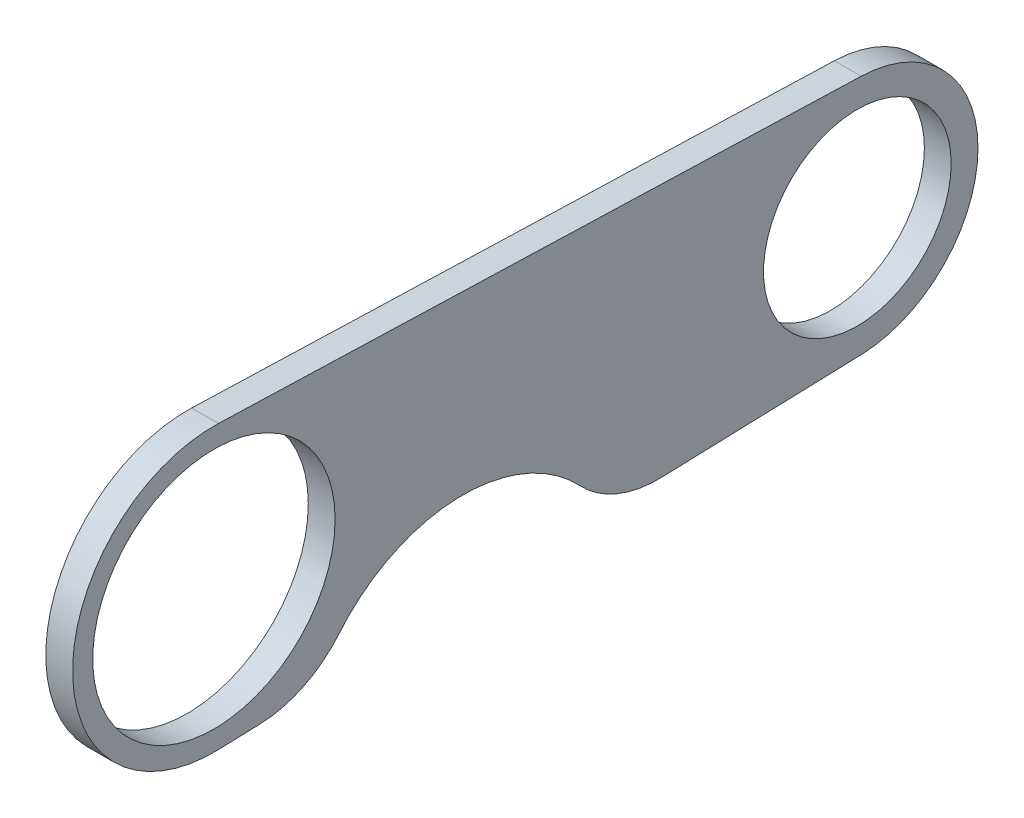
from build123d import *

# Parameters (mm, degrees)
SKETCH1_R           = 14.351
SKETCH1_R_2         = 11.1125
BOSS_EXTRUDE1_DEPTH = 3.175
SKETCH2_R           = 19.05
CUT_EXTRUDE1_DEPTH  = 58.416238601
FILLET1_R           = 12.7


with BuildPart() as part:
    # Sketch1 → Boss-Extrude1 (new body)
    with BuildSketch(Plane(origin=(0, 0, 0), x_dir=(0, 0, -1), z_dir=(1, 0, 0))):
        with BuildLine():
            Line((-37.563173646, 16.723636193), (38.558390625, 14.280144757))
            ThreePointArc((38.558390625, 14.280144757), (52.3875, 0), (38.558390625, -14.280144757))
            Line((38.558390625, -14.280144757), (-37.563173646, -16.723636193))
            ThreePointArc((-37.563173646, -16.723636193), (-54.83225, 0), (-37.563173646, 16.723636193))
        make_face()
        with Locations((-38.1, 0)):
            Circle(SKETCH1_R, mode=Mode.SUBTRACT)
        with Locations((38.1, 0)):
            Circle(SKETCH1_R_2, mode=Mode.SUBTRACT)
    extrude(amount=BOSS_EXTRUDE1_DEPTH)

    # Sketch2 → Cut-Extrude1 (cut, through all)
    with BuildSketch(Plane(origin=(3.175, 0, 0), x_dir=(0, 0, -1), z_dir=(1, 0, 0))):
        with Locations((-8.615205614, -24.13)):
            Circle(SKETCH2_R)
    extrude(amount=-CUT_EXTRUDE1_DEPTH, mode=Mode.SUBTRACT)

    # Fillet1
    fillet1_edges = [part.edges().sort_by_distance(p)[0] for p in [
        (1.5875, -15.253351608, -8.240286468),
        (1.5875, -16.352629743, 26.005289337),
    ]]
    fillet(fillet1_edges, radius=FILLET1_R)


solid = part.part
